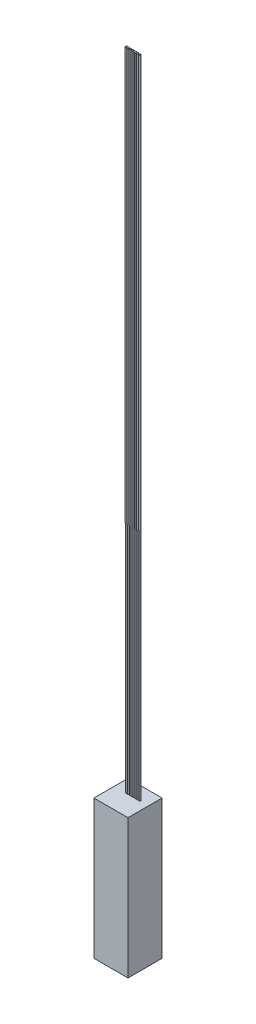
from build123d import *

# Parameters (mm, degrees)
FIBER_BLOCK_SKETCH_W = 2.47855
FIBER_BLOCK_SKETCH_H = 2.47855
FIBER_BLOCK_DEPTH    = 10.1
FIBER_SKETCH_R       = 0.05
FIBERS_DEPTH         = 17
FIBER_SHIELD_START   = 17
FIBER_SKETCH_3_R     = 0.065
FIBER_SKETCH_3_R_2   = 0.05
FIBER_SHIELD_DEPTH   = 30


with BuildPart() as part:
    # Fiber_Block_sketch → Fiber_Block (new body)
    with BuildSketch(Plane(origin=(0, 0, 0), x_dir=(1, 0, 0), z_dir=(0, 1, 0))):
        with Locations((1.239275, -1.239275)):
            Rectangle(FIBER_BLOCK_SKETCH_W, FIBER_BLOCK_SKETCH_H)
    extrude(amount=FIBER_BLOCK_DEPTH)

    # Fiber_Sketch → Fibers (add)
    with BuildSketch(Plane(origin=(0, 10.1, 0), x_dir=(1, 0, 0), z_dir=(0, 1, 0))):
        with Locations(Location((0.85, -0.968, 0), (0, 0, 270))):
            Circle(FIBER_SKETCH_R)
        with Locations(Location((0.99, -0.968, 0), (0, 0, 270))):
            Circle(FIBER_SKETCH_R)
        with Locations(Location((1.13, -0.968, 0), (0, 0, 270))):
            Circle(FIBER_SKETCH_R)
        with Locations(Location((1.27, -0.968, 0), (0, 0, 270))):
            Circle(FIBER_SKETCH_R)
        with Locations(Location((1.41, -0.968, 0), (0, 0, 270))):
            Circle(FIBER_SKETCH_R)
        with Locations(Location((1.55, -0.968, 0), (0, 0, 270))):
            Circle(FIBER_SKETCH_R)
        with Locations(Location((1.69, -0.968, 0), (0, 0, 270))):
            Circle(FIBER_SKETCH_R)
        with Locations(Location((1.83, -0.968, 0), (0, 0, 270))):
            Circle(FIBER_SKETCH_R)
    extrude(amount=FIBERS_DEPTH)


with BuildPart() as body_2:
    # Fiber_Sketch<3> → Fiber_Shield (new body)
    # profile 1 of 16: a face of its own
    with BuildSketch(Plane(origin=(0, 10.1, 0), x_dir=(1, 0, 0), z_dir=(0, 1, 0)).offset(FIBER_SHIELD_START)):
        with Locations(Location((0.85, -0.968, 0), (0, 0, 270))):
            Circle(FIBER_SKETCH_3_R)
        with Locations(Location((0.85, -0.968, 0), (0, 0, 270))):
            Circle(FIBER_SKETCH_3_R_2, mode=Mode.SUBTRACT)
    # profile 2 of 16: a face of its own
    with BuildSketch(Plane(origin=(0, 10.1, 0), x_dir=(1, 0, 0), z_dir=(0, 1, 0)).offset(FIBER_SHIELD_START)):
        with Locations(Location((0.99, -0.968, 0), (0, 0, 270))):
            Circle(FIBER_SKETCH_3_R)
        with Locations(Location((0.99, -0.968, 0), (0, 0, 270))):
            Circle(FIBER_SKETCH_3_R_2, mode=Mode.SUBTRACT)
    # profile 3 of 16: a face of its own
    with BuildSketch(Plane(origin=(0, 10.1, 0), x_dir=(1, 0, 0), z_dir=(0, 1, 0)).offset(FIBER_SHIELD_START)):
        with Locations(Location((1.13, -0.968, 0), (0, 0, 270))):
            Circle(FIBER_SKETCH_3_R)
        with Locations(Location((1.13, -0.968, 0), (0, 0, 270))):
            Circle(FIBER_SKETCH_3_R_2, mode=Mode.SUBTRACT)
    # profile 4 of 16: a face of its own
    with BuildSketch(Plane(origin=(0, 10.1, 0), x_dir=(1, 0, 0), z_dir=(0, 1, 0)).offset(FIBER_SHIELD_START)):
        with Locations(Location((1.27, -0.968, 0), (0, 0, 270))):
            Circle(FIBER_SKETCH_3_R)
        with Locations(Location((1.27, -0.968, 0), (0, 0, 270))):
            Circle(FIBER_SKETCH_3_R_2, mode=Mode.SUBTRACT)
    # profile 5 of 16: a face of its own
    with BuildSketch(Plane(origin=(0, 10.1, 0), x_dir=(1, 0, 0), z_dir=(0, 1, 0)).offset(FIBER_SHIELD_START)):
        with Locations(Location((1.41, -0.968, 0), (0, 0, 270))):
            Circle(FIBER_SKETCH_3_R)
        with Locations(Location((1.41, -0.968, 0), (0, 0, 270))):
            Circle(FIBER_SKETCH_3_R_2, mode=Mode.SUBTRACT)
    # profile 6 of 16: a face of its own
    with BuildSketch(Plane(origin=(0, 10.1, 0), x_dir=(1, 0, 0), z_dir=(0, 1, 0)).offset(FIBER_SHIELD_START)):
        with Locations(Location((1.55, -0.968, 0), (0, 0, 270))):
            Circle(FIBER_SKETCH_3_R)
        with Locations(Location((1.55, -0.968, 0), (0, 0, 270))):
            Circle(FIBER_SKETCH_3_R_2, mode=Mode.SUBTRACT)
    # profile 7 of 16: a face of its own
    with BuildSketch(Plane(origin=(0, 10.1, 0), x_dir=(1, 0, 0), z_dir=(0, 1, 0)).offset(FIBER_SHIELD_START)):
        with Locations(Location((1.69, -0.968, 0), (0, 0, 270))):
            Circle(FIBER_SKETCH_3_R)
        with Locations(Location((1.69, -0.968, 0), (0, 0, 270))):
            Circle(FIBER_SKETCH_3_R_2, mode=Mode.SUBTRACT)
    # profile 8 of 16: a face of its own
    with BuildSketch(Plane(origin=(0, 10.1, 0), x_dir=(1, 0, 0), z_dir=(0, 1, 0)).offset(FIBER_SHIELD_START)):
        with Locations(Location((1.83, -0.968, 0), (0, 0, 270))):
            Circle(FIBER_SKETCH_3_R)
        with Locations(Location((1.83, -0.968, 0), (0, 0, 270))):
            Circle(FIBER_SKETCH_3_R_2, mode=Mode.SUBTRACT)
    # profile 9 of 16: a face of its own
    with BuildSketch(Plane(origin=(0, 10.1, 0), x_dir=(1, 0, 0), z_dir=(0, 1, 0)).offset(FIBER_SHIELD_START)):
        with Locations(Location((1.83, -0.968, 0), (0, 0, 270))):
            Circle(FIBER_SKETCH_3_R_2)
    # profile 10 of 16: a face of its own
    with BuildSketch(Plane(origin=(0, 10.1, 0), x_dir=(1, 0, 0), z_dir=(0, 1, 0)).offset(FIBER_SHIELD_START)):
        with Locations(Location((1.69, -0.968, 0), (0, 0, 270))):
            Circle(FIBER_SKETCH_3_R_2)
    # profile 11 of 16: a face of its own
    with BuildSketch(Plane(origin=(0, 10.1, 0), x_dir=(1, 0, 0), z_dir=(0, 1, 0)).offset(FIBER_SHIELD_START)):
        with Locations(Location((1.55, -0.968, 0), (0, 0, 270))):
            Circle(FIBER_SKETCH_3_R_2)
    # profile 12 of 16: a face of its own
    with BuildSketch(Plane(origin=(0, 10.1, 0), x_dir=(1, 0, 0), z_dir=(0, 1, 0)).offset(FIBER_SHIELD_START)):
        with Locations(Location((1.41, -0.968, 0), (0, 0, 270))):
            Circle(FIBER_SKETCH_3_R_2)
    # profile 13 of 16: a face of its own
    with BuildSketch(Plane(origin=(0, 10.1, 0), x_dir=(1, 0, 0), z_dir=(0, 1, 0)).offset(FIBER_SHIELD_START)):
        with Locations(Location((1.27, -0.968, 0), (0, 0, 270))):
            Circle(FIBER_SKETCH_3_R_2)
    # profile 14 of 16: a face of its own
    with BuildSketch(Plane(origin=(0, 10.1, 0), x_dir=(1, 0, 0), z_dir=(0, 1, 0)).offset(FIBER_SHIELD_START)):
        with Locations(Location((0.85, -0.968, 0), (0, 0, 270))):
            Circle(FIBER_SKETCH_3_R_2)
    # profile 15 of 16: a face of its own
    with BuildSketch(Plane(origin=(0, 10.1, 0), x_dir=(1, 0, 0), z_dir=(0, 1, 0)).offset(FIBER_SHIELD_START)):
        with Locations(Location((0.99, -0.968, 0), (0, 0, 270))):
            Circle(FIBER_SKETCH_3_R_2)
    # profile 16 of 16: a face of its own
    with BuildSketch(Plane(origin=(0, 10.1, 0), x_dir=(1, 0, 0), z_dir=(0, 1, 0)).offset(FIBER_SHIELD_START)):
        with Locations(Location((1.13, -0.968, 0), (0, 0, 270))):
            Circle(FIBER_SKETCH_3_R_2)
    extrude(amount=FIBER_SHIELD_DEPTH)


solid = Compound([part.part, body_2.part])
